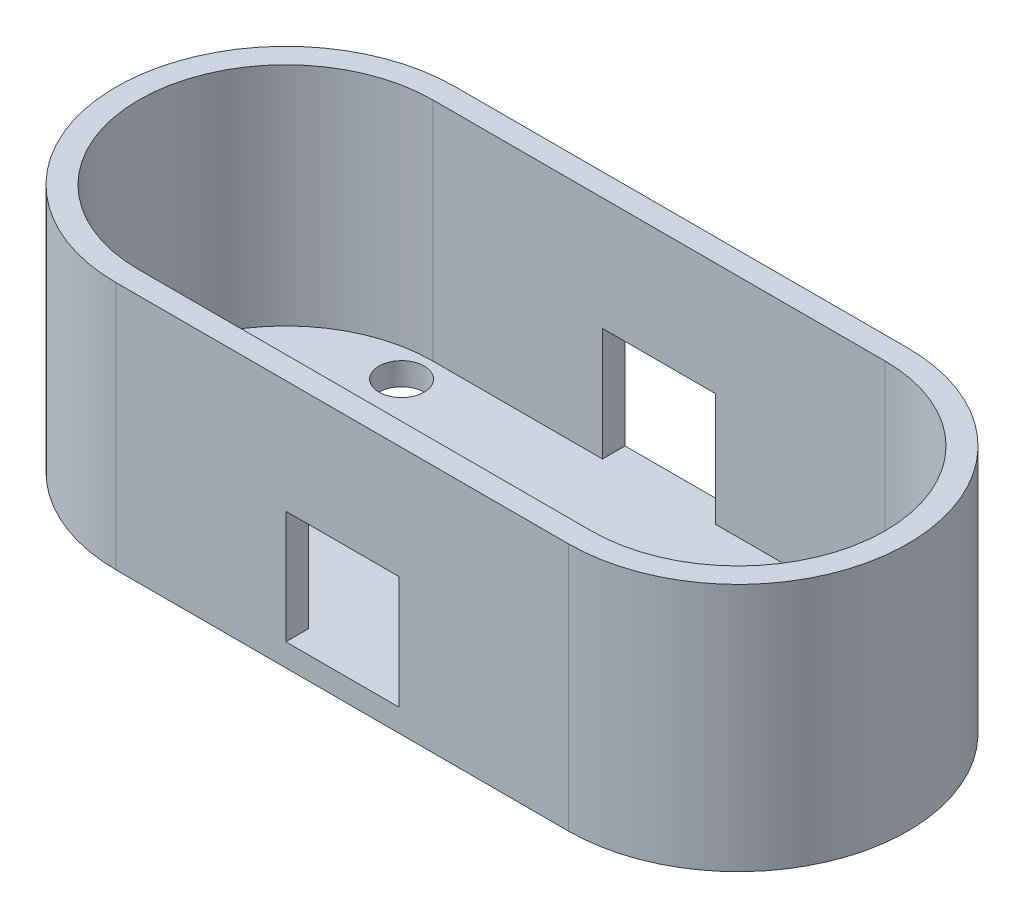
from build123d import *

# Parameters (mm, degrees)
BOSS_EXTRUDE1_DEPTH = 12.7
BOSS_EXTRUDE2_START = 1.27
BOSS_EXTRUDE2_DEPTH = 1.27
SKETCH4_W           = 6.35
SKETCH4_H           = 6.35
CUT_EXTRUDE1_DEPTH  = 42.760604941
CUT_EXTRUDE2_REACH  = 40.364
SKETCH5_R           = 1.27


with BuildPart() as part:
    # Sketch2 → Boss-Extrude1 (new body)
    with BuildSketch(Plane(origin=(0, 0, 0), x_dir=(1, 0, 0), z_dir=(0, 1, 0))):
        with BuildLine():
            Line((0, 9.525), (25.4, 9.525))
            ThreePointArc((25.4, 9.525), (34.925, 0), (25.4, -9.525))
            Line((25.4, -9.525), (0, -9.525))
            ThreePointArc((0, -9.525), (-9.525, 0), (0, 9.525))
        make_face()
        with BuildLine():
            Line((0, 8.255), (25.4, 8.255))
            ThreePointArc((25.4, 8.255), (33.655, 0), (25.4, -8.255))
            Line((25.4, -8.255), (0, -8.255))
            ThreePointArc((0, -8.255), (-8.255, 0), (0, 8.255))
        make_face(mode=Mode.SUBTRACT)
    extrude(amount=BOSS_EXTRUDE1_DEPTH)

    # Sketch3 → Boss-Extrude2 (add)
    with BuildSketch(Plane.XZ.offset(BOSS_EXTRUDE2_START)):
        with BuildLine():
            Line((0, 9.525), (25.4, 9.525))
            ThreePointArc((25.4, 9.525), (34.925, 0), (25.4, -9.525))
            Line((25.4, -9.525), (0, -9.525))
            ThreePointArc((0, -9.525), (-9.525, 0), (0, 9.525))
        make_face()
    extrude(amount=-BOSS_EXTRUDE2_DEPTH)

    # Sketch4 → Cut-Extrude1 (cut, through all)
    with BuildSketch(Plane.XY.offset(9.525)):
        with Locations((12.7, 3.175)):
            Rectangle(SKETCH4_W, SKETCH4_H)
    extrude(amount=-CUT_EXTRUDE1_DEPTH, mode=Mode.SUBTRACT)

    # Sketch5 → Cut-Extrude2 (cut, up to next)
    with BuildSketch(Plane(origin=(0, 0, 0), x_dir=(1, 0, 0), z_dir=(0, 1, 0)), mode=Mode.PRIVATE) as cut_extrude2_sk1:
        with Locations(Location((-6.12696281, 0, 0), (0, 0, 270))):
            Circle(SKETCH5_R)
    cut_extrude2_tool1 = extrude(cut_extrude2_sk1.sketch, amount=-CUT_EXTRUDE2_REACH, mode=Mode.PRIVATE) & part.part
    # Sketch5 → Cut-Extrude2 (cut, up to next)
    with BuildSketch(Plane(origin=(0, 0, 0), x_dir=(1, 0, 0), z_dir=(0, 1, 0)), mode=Mode.PRIVATE) as cut_extrude2_sk2:
        with Locations(Location((32.190803921, 0, 0), (0, 0, 270))):
            Circle(SKETCH5_R)
    cut_extrude2_tool2 = extrude(cut_extrude2_sk2.sketch, amount=-CUT_EXTRUDE2_REACH, mode=Mode.PRIVATE) & part.part
    # Sketch5 → Cut-Extrude2 (cut, up to next)
    with BuildSketch(Plane(origin=(0, 0, 0), x_dir=(1, 0, 0), z_dir=(0, 1, 0)), mode=Mode.PRIVATE) as cut_extrude2_sk3:
        with Locations(Location((0, 6.499696211, 0), (0, 0, 270))):
            Circle(SKETCH5_R)
    cut_extrude2_tool3 = extrude(cut_extrude2_sk3.sketch, amount=-CUT_EXTRUDE2_REACH, mode=Mode.PRIVATE) & part.part
    # Sketch5 → Cut-Extrude2 (cut, up to next)
    with BuildSketch(Plane(origin=(0, 0, 0), x_dir=(1, 0, 0), z_dir=(0, 1, 0)), mode=Mode.PRIVATE) as cut_extrude2_sk4:
        with Locations(Location((0, -5.991753651, 0), (0, 0, 270))):
            Circle(SKETCH5_R)
    cut_extrude2_tool4 = extrude(cut_extrude2_sk4.sketch, amount=-CUT_EXTRUDE2_REACH, mode=Mode.PRIVATE) & part.part
    # Sketch5 → Cut-Extrude2 (cut, up to next)
    with BuildSketch(Plane(origin=(0, 0, 0), x_dir=(1, 0, 0), z_dir=(0, 1, 0)), mode=Mode.PRIVATE) as cut_extrude2_sk5:
        with Locations(Location((26.63537738, 6.499696211, 0), (0, 0, 270))):
            Circle(SKETCH5_R)
    cut_extrude2_tool5 = extrude(cut_extrude2_sk5.sketch, amount=-CUT_EXTRUDE2_REACH, mode=Mode.PRIVATE) & part.part
    # Sketch5 → Cut-Extrude2 (cut, up to next)
    with BuildSketch(Plane(origin=(0, 0, 0), x_dir=(1, 0, 0), z_dir=(0, 1, 0)), mode=Mode.PRIVATE) as cut_extrude2_sk6:
        with Locations(Location((26.63537738, -5.991753651, 0), (0, 0, 270))):
            Circle(SKETCH5_R)
    cut_extrude2_tool6 = extrude(cut_extrude2_sk6.sketch, amount=-CUT_EXTRUDE2_REACH, mode=Mode.PRIVATE) & part.part
    add(cut_extrude2_tool1.solids().sort_by_distance((-6.126963, 0, 0))[0], mode=Mode.SUBTRACT)
    add(cut_extrude2_tool2.solids().sort_by_distance((32.190804, 0, 0))[0], mode=Mode.SUBTRACT)
    add(cut_extrude2_tool3.solids().sort_by_distance((0, 0, -6.499696))[0], mode=Mode.SUBTRACT)
    add(cut_extrude2_tool4.solids().sort_by_distance((0, 0, 5.991754))[0], mode=Mode.SUBTRACT)
    add(cut_extrude2_tool5.solids().sort_by_distance((26.635377, 0, -6.499696))[0], mode=Mode.SUBTRACT)
    add(cut_extrude2_tool6.solids().sort_by_distance((26.635377, 0, 5.991754))[0], mode=Mode.SUBTRACT)


solid = part.part
